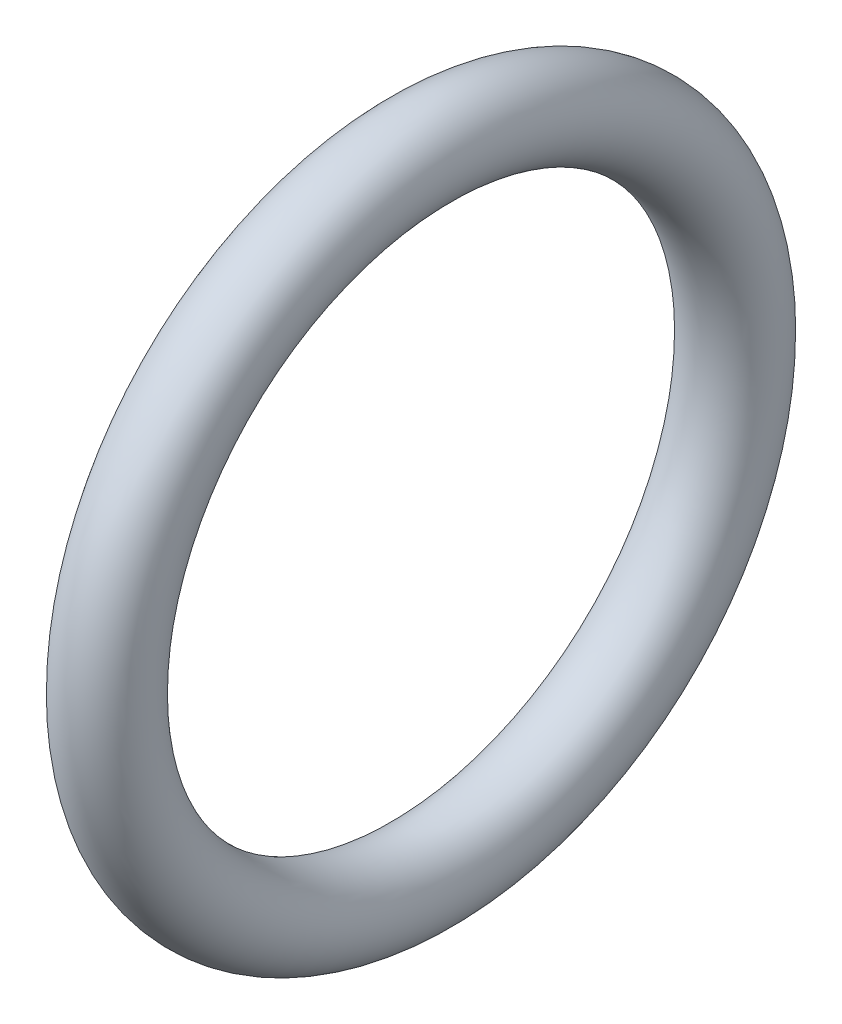
from build123d import *

# Parameters (mm, degrees)
SKETCH_1_R = 9


with BuildPart() as part:
    # Эскиз1 → Повернуть1 (revolve)
    with BuildSketch(Plane.XY, mode=Mode.PRIVATE) as revolve_1_sk:
        Circle(SKETCH_1_R)
    revolve(revolve_1_sk.sketch.rotate(Axis((-17.804302576, -66, 0), (1, 0, 0)), 90), axis=Axis((-17.804302576, -66, 0), (1, 0, 0)))


solid = part.part
